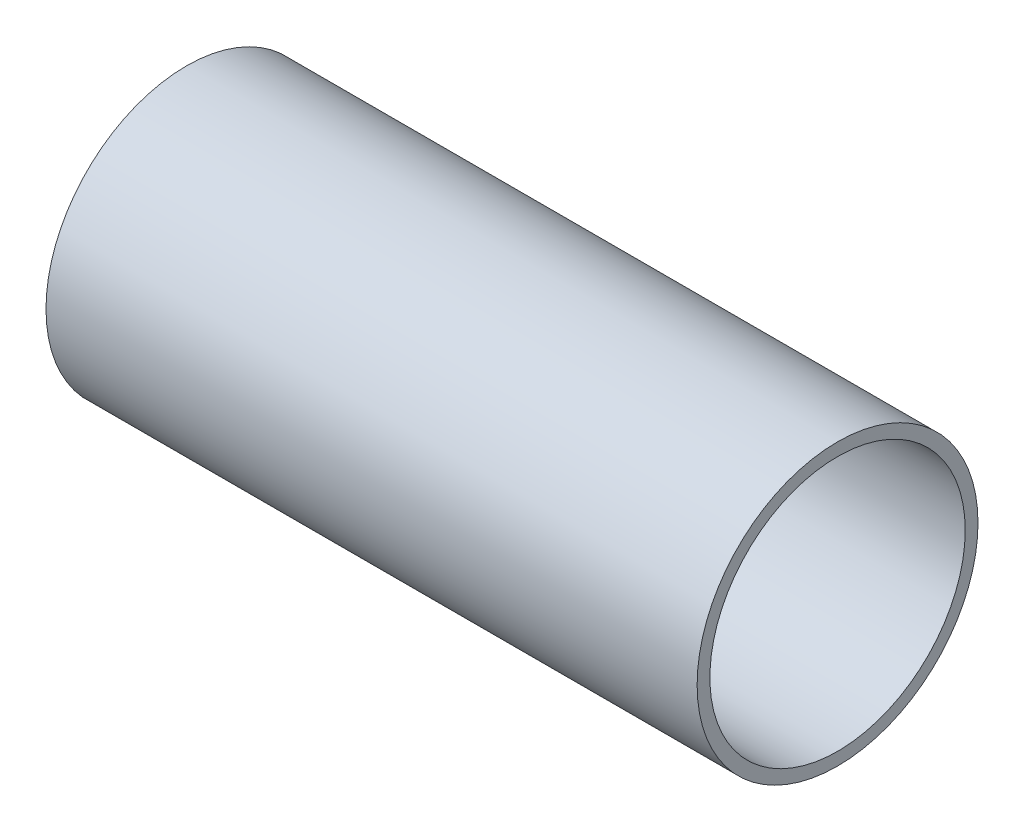
from build123d import *

# Parameters (mm, degrees)
SKETCH1_R           = 22
SKETCH1_R_2         = 20
BOSS_EXTRUDE1_DEPTH = 102


with BuildPart() as part:
    # Sketch1 → Boss-Extrude1 (new body)
    with BuildSketch(Plane(origin=(0, 0, 0), x_dir=(0, 0, -1), z_dir=(1, 0, 0))):
        Circle(SKETCH1_R)
        Circle(SKETCH1_R_2, mode=Mode.SUBTRACT)
    extrude(amount=BOSS_EXTRUDE1_DEPTH)


solid = part.part
